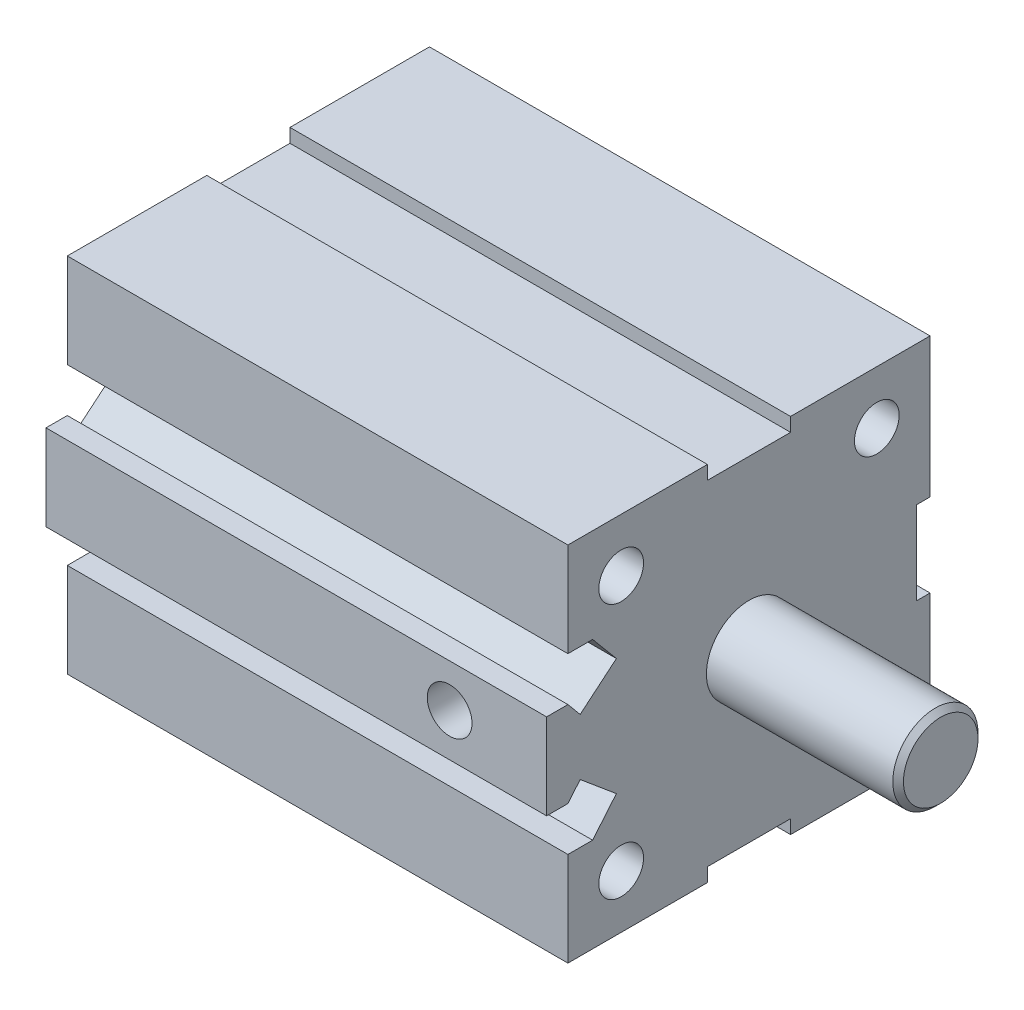
from build123d import *

# Parameters (mm, degrees)
SKETCH_1_W          = 34
SKETCH_1_H          = 34
EXTRUDE_1_DEPTH     = 23.5
SKETCH_2_W          = 7.807367758
SKETCH_2_H          = 1.293413098
SKETCH_2_W_2        = 1.293413098
SKETCH_2_H_2        = 7.807367758
CUT_EXTRUDE_1_DEPTH = 53.792044855
CUT_EXTRUDE_2_DEPTH = 53.792044855
SKETCH_4_W          = 2
SKETCH_4_H          = 8.049048512
EXTRUDE_2_DEPTH     = 47
M5X0_8_1_D          = 4.2
M5X0_8_1_DEPTH      = 12.4
M5X0_8_1_TIP        = 1.2618073
SKETCH_7_R          = 4
EXTRUDE_3_DEPTH     = 18
EXTRUDE_START       = 8
SKETCH_8_R          = 4
EXTRUDE_4_DEPTH     = 8
M4X0_7_1_D          = 3.3
M4X0_7_1_DEPTH      = 10.1
M4X0_7_1_TIP        = 0.991420021
M5X0_8_2_D          = 4.2
M5X0_8_2_DEPTH      = 12.4
M5X0_8_2_TIP        = 1.2618073
CHAMFER_1_SIZE      = 0.5


with BuildPart() as part:
    # 草图1 → 凸台-拉伸1 (new, symmetric)
    with BuildSketch(Plane(origin=(0, 0, 0), x_dir=(0, 0, -1), z_dir=(1, 0, 0))):
        Rectangle(SKETCH_1_W, SKETCH_1_H)
    extrude(amount=EXTRUDE_1_DEPTH, both=True)

    # 草图2 → 切除-拉伸1 (cut, through all)
    with BuildSketch(Plane(origin=(23.5, 0, 0), x_dir=(0, 0, -1), z_dir=(1, 0, 0))):
        with Locations((0, 16.353293451)):
            Rectangle(SKETCH_2_W, SKETCH_2_H)
        with Locations((0, -16.353293451)):
            Rectangle(SKETCH_2_W, SKETCH_2_H)
        with Locations((16.353293451, 0)):
            Rectangle(SKETCH_2_W_2, SKETCH_2_H_2)
    extrude(amount=-CUT_EXTRUDE_1_DEPTH, mode=Mode.SUBTRACT)

    # 草图3 → 切除-拉伸2 (cut, through all)
    with BuildSketch(Plane(origin=(23.5, 0, 0), x_dir=(0, 0, -1), z_dir=(1, 0, 0))):
        Polygon((-17, 8.160891433), (-14.681905921, 8.160891433), (-12.449444795, 5.490864716), (-15.849248052, 2.648223271), (-17, 4.024524256), align=None)
        Polygon((-17, -4.024524256), (-17, -8.160891433), (-14.681905921, -8.160891433), (-12.449444795, -5.490864716), (-15.849248052, -2.648223271), align=None)
    extrude(amount=-CUT_EXTRUDE_2_DEPTH, mode=Mode.SUBTRACT)

    # 草图4 → 凸台-拉伸2 (add)
    with BuildSketch(Plane(origin=(23.5, 0, 0), x_dir=(0, 0, -1), z_dir=(1, 0, 0))):
        with Locations((-18, 0)):
            Rectangle(SKETCH_4_W, SKETCH_4_H)
    extrude(amount=-EXTRUDE_2_DEPTH)

    # M5x0.8 螺纹孔1
    with Locations(Plane.XY.offset(19)):
        with Locations((14.396569206, 0)):
            Hole(M5X0_8_1_D / 2, depth=M5X0_8_1_DEPTH)
            with Locations((0, 0, -(M5X0_8_1_DEPTH + M5X0_8_1_TIP / 2))):  # 118° drill point
                Cone(0, M5X0_8_1_D / 2, M5X0_8_1_TIP, mode=Mode.SUBTRACT)

    # 草图7 → 凸台-拉伸3 (add)
    with BuildSketch(Plane(origin=(23.5, 0, 0), x_dir=(0, 0, -1), z_dir=(1, 0, 0))):
        Circle(SKETCH_7_R)
    extrude(amount=EXTRUDE_3_DEPTH)

    # 草图8 → 凸台-拉伸4 (add)
    with BuildSketch(Plane.ZY.offset(23.5).offset(EXTRUDE_START)):
        with Locations(Location((0, 0, 0), (0, 0, 180))):
            Circle(SKETCH_8_R)
    extrude(amount=-EXTRUDE_4_DEPTH)

    # M4x0.7 螺纹孔1
    with Locations(Plane.ZY.offset(31.5)):
        with Locations((0, 0)):
            Hole(M4X0_7_1_D / 2, depth=M4X0_7_1_DEPTH)
            with Locations((0, 0, -(M4X0_7_1_DEPTH + M4X0_7_1_TIP / 2))):  # 118° drill point
                Cone(0, M4X0_7_1_D / 2, M4X0_7_1_TIP, mode=Mode.SUBTRACT)

    # M5x0.8 螺纹孔2
    with Locations(Plane(origin=(23.5, 0, 0), x_dir=(0, 0, -1), z_dir=(1, 0, 0))):
        with Locations((-12, 12), (12, 12), (12, -12), (-12, -12)):
            Hole(M5X0_8_2_D / 2, depth=M5X0_8_2_DEPTH)
            with Locations((0, 0, -(M5X0_8_2_DEPTH + M5X0_8_2_TIP / 2))):  # 118° drill point
                Cone(0, M5X0_8_2_D / 2, M5X0_8_2_TIP, mode=Mode.SUBTRACT)

    # 倒角1
    chamfer_1_edges = [part.edges().sort_by_distance(p)[0] for p in [
        (41.5, 0, 4),
    ]]
    chamfer(chamfer_1_edges, length=CHAMFER_1_SIZE)


solid = part.part
